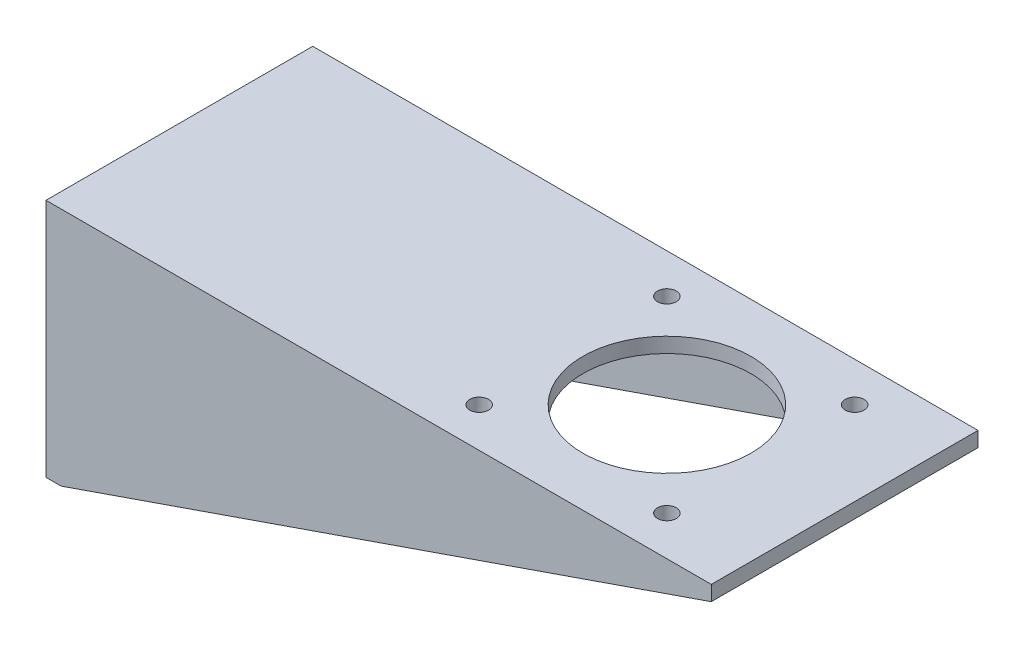
from build123d import *

# Parameters (mm, degrees)
BOSS_EXTRUDE1_DEPTH       = 17.78
CUT_EXTRUDE1_DEPTH        = 16.78
CUT_EXTRUDE1_DEPTH_BACK   = 16.78
SKETCH4_R                 = 8
CUT_EXTRUDE2_DEPTH        = 91.122241428
SKETCH5_R                 = 11.2
CUT_EXTRUDE3_DEPTH        = 96.309067774
BOSS_EXTRUDE2_DEPTH       = 2
M3X0_5_TAPPED_HOLE2_D     = 2.5
M3X0_5_TAPPED_HOLE2_DEPTH = 7.5
M3X0_5_TAPPED_HOLE2_TIP   = 0.751075774
FILLET6_R                 = 2
M3_CLEARANCE_HOLE1_D      = 3.4
M3_CLEARANCE_HOLE1_DEPTH  = 12.7


with BuildPart() as part:
    # Sketch1 → Boss-Extrude1 (new, symmetric)
    with BuildSketch(Plane.XY):
        Polygon((0, -15), (0, 15), (0, 17), (2, 17), (88.7, 17), (88.7, 15), (2, -15), align=None)
    extrude(amount=BOSS_EXTRUDE1_DEPTH, both=True)

    # Sketch2 → Cut-Extrude1 (cut, two sides: drawn at the far end of the back side and taken through both)
    with BuildSketch(Plane.XY.offset(-CUT_EXTRUDE1_DEPTH_BACK)):
        Polygon((2, 15), (2, -15), (88.7, 15), align=None)
    extrude(amount=CUT_EXTRUDE1_DEPTH + CUT_EXTRUDE1_DEPTH_BACK, mode=Mode.SUBTRACT)

    # Sketch4 → Cut-Extrude2 (cut, through all)
    with BuildSketch(Plane(origin=(2, 0, 0), x_dir=(0, 0, -1), z_dir=(1, 0, 0))):
        with Locations(Location((0, -1, 0), (0, 0, 90))):
            Circle(SKETCH4_R)
    extrude(amount=-CUT_EXTRUDE2_DEPTH, mode=Mode.SUBTRACT)

    # Sketch5 → Cut-Extrude3 (cut, through all)
    with BuildSketch(Plane.XZ.offset(-15)):
        with Locations((65, 0)):
            Circle(SKETCH5_R)
    extrude(amount=-CUT_EXTRUDE3_DEPTH, mode=Mode.SUBTRACT)

    # Sketch7 → Boss-Extrude2 (add)
    with BuildSketch(Plane.XZ.offset(-15)):
        with BuildLine():
            Line((49.484209973, -12.515790027), (49.484209973, -16.78))
            Line((49.484209973, -16.78), (55.484209973, -16.78))
            Line((55.484209973, -16.78), (55.484209973, -12.515790027))
            ThreePointArc((55.484209973, -12.515790027), (52.484209973, -9.515790027), (49.484209973, -12.515790027))
        make_face()
        with BuildLine():
            Line((74.515790027, -12.515790027), (74.515790027, -16.78))
            Line((74.515790027, -16.78), (80.515790027, -16.78))
            Line((80.515790027, -16.78), (80.515790027, -12.515790027))
            ThreePointArc((80.515790027, -12.515790027), (77.515790027, -9.515790027), (74.515790027, -12.515790027))
        make_face()
        with BuildLine():
            Line((80.515790027, 12.515790027), (80.515790027, 16.78))
            Line((80.515790027, 16.78), (74.515790027, 16.78))
            Line((74.515790027, 16.78), (74.515790027, 12.515790027))
            ThreePointArc((74.515790027, 12.515790027), (77.515790027, 9.515790027), (80.515790027, 12.515790027))
        make_face()
        with BuildLine():
            Line((49.484209973, 12.515790027), (49.484209973, 16.78))
            Line((49.484209973, 16.78), (55.484209973, 16.78))
            Line((55.484209973, 16.78), (55.484209973, 12.515790027))
            ThreePointArc((55.484209973, 12.515790027), (52.484209973, 9.515790027), (49.484209973, 12.515790027))
        make_face()
    extrude(amount=BOSS_EXTRUDE2_DEPTH)

    # M3x0.5 Tapped Hole2
    with Locations(Plane(origin=(0, 13, 0), x_dir=(-1, 0, 0), z_dir=(0, -1, 0))):
        with Locations((-52.484209973, -12.515790027), (-77.515790027, -12.515790027), (-77.515790027, 12.515790027), (-52.484209973, 12.515790027)):
            Hole(M3X0_5_TAPPED_HOLE2_D / 2, depth=M3X0_5_TAPPED_HOLE2_DEPTH)
            with Locations((0, 0, -(M3X0_5_TAPPED_HOLE2_DEPTH + M3X0_5_TAPPED_HOLE2_TIP / 2))):  # 118° drill point
                Cone(0, M3X0_5_TAPPED_HOLE2_D / 2, M3X0_5_TAPPED_HOLE2_TIP, mode=Mode.SUBTRACT)

    # Fillet6
    fillet6_edges = [part.edges().sort_by_distance(p)[0] for p in [
        (2, 0, -16.78),
        (2, 0, 16.78),
        (49.484209973, 14, -16.78),
        (55.484209973, 14, -16.78),
        (74.515790027, 14, -16.78),
        (80.515790027, 14, -16.78),
        (80.515790027, 14, 16.78),
        (74.515790027, 14, 16.78),
        (55.484209973, 14, 16.78),
        (49.484209973, 14, 16.78),
    ]]
    fillet(fillet6_edges, radius=FILLET6_R)

    # M3 Clearance Hole1
    with Locations(Plane.ZY):
        with Locations((0, 9), (10, -1), (0, -11), (-10, -1)):
            Hole(M3_CLEARANCE_HOLE1_D / 2, depth=M3_CLEARANCE_HOLE1_DEPTH)


solid = part.part
